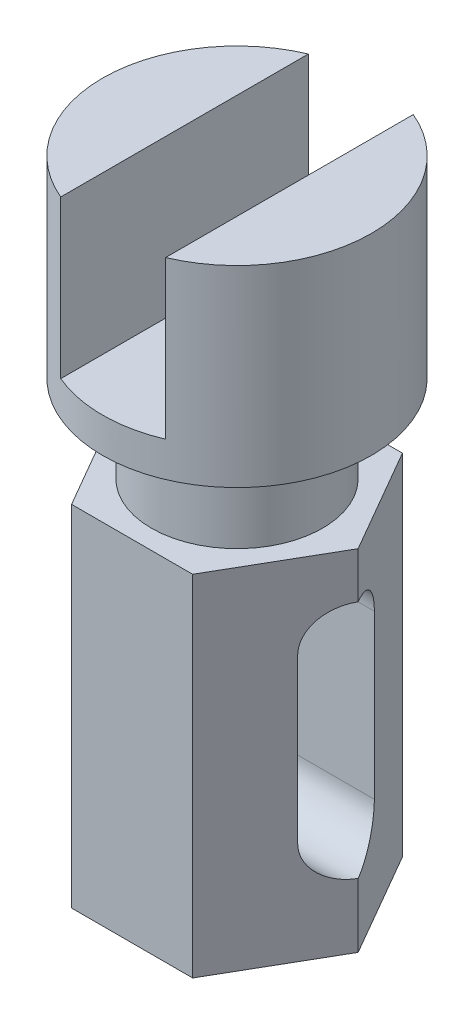
from build123d import *

# Parameters (mm, degrees)
BOSS_EXTRUDE1_DEPTH = 100
SKETCH5_R           = 24.5
BOSS_EXTRUDE3_DEPTH = 25
SKETCH7_R           = 38.461674467
BOSS_EXTRUDE4_DEPTH = 55
SKETCH8_W           = 30
SKETCH8_H           = 78.949061688
CUT_EXTRUDE1_DEPTH  = 45
CUT_EXTRUDE2_DEPTH  = 42.5


with BuildPart() as part:
    # Sketch4 → Boss-Extrude1 (new body)
    with BuildSketch(Plane(origin=(0, 0, 0), x_dir=(1, 0, 0), z_dir=(0, 1, 0))):
        Polygon((34.641016151, 0), (17.320508076, 30), (-17.320508076, 30), (-34.641016151, 0), (-17.320508076, -30), (17.320508076, -30), align=None)
    extrude(amount=BOSS_EXTRUDE1_DEPTH)

    # Sketch5 → Boss-Extrude3 (add)
    with BuildSketch(Plane(origin=(0, 100, 0), x_dir=(1, 0, 0), z_dir=(0, 1, 0))):
        with Locations(Location((0, 0, 0), (0, 0, 270))):
            Circle(SKETCH5_R)
    extrude(amount=BOSS_EXTRUDE3_DEPTH)

    # Sketch7 → Boss-Extrude4 (add)
    with BuildSketch(Plane(origin=(0, 125, 0), x_dir=(1, 0, 0), z_dir=(0, 1, 0))):
        with Locations(Location((0, 0, 0), (0, 0, 270))):
            Circle(SKETCH7_R)
    extrude(amount=BOSS_EXTRUDE4_DEPTH)

    # Sketch8 → Cut-Extrude1 (cut)
    with BuildSketch(Plane(origin=(0, 180, 0), x_dir=(1, 0, 0), z_dir=(0, 1, 0))):
        Rectangle(SKETCH8_W, SKETCH8_H)
    extrude(amount=-CUT_EXTRUDE1_DEPTH, mode=Mode.SUBTRACT)

    # Sketch9 → Cut-Extrude2 (cut, symmetric)
    with BuildSketch(Plane(origin=(0, 0, 0), x_dir=(0, 0, -1), z_dir=(1, 0, 0))):
        with BuildLine():
            Line((10.959896638, 75.869076848), (10.959896638, 29.285757766))
            ThreePointArc((10.959896638, 29.285757766), (0, 18.325861128), (-10.959896638, 29.285757766))
            Line((-10.959896638, 29.285757766), (-10.959896638, 75.869076848))
            ThreePointArc((-10.959896638, 75.869076848), (0, 86.828973486), (10.959896638, 75.869076848))
        make_face()
    extrude(amount=CUT_EXTRUDE2_DEPTH, both=True, mode=Mode.SUBTRACT)


solid = part.part
